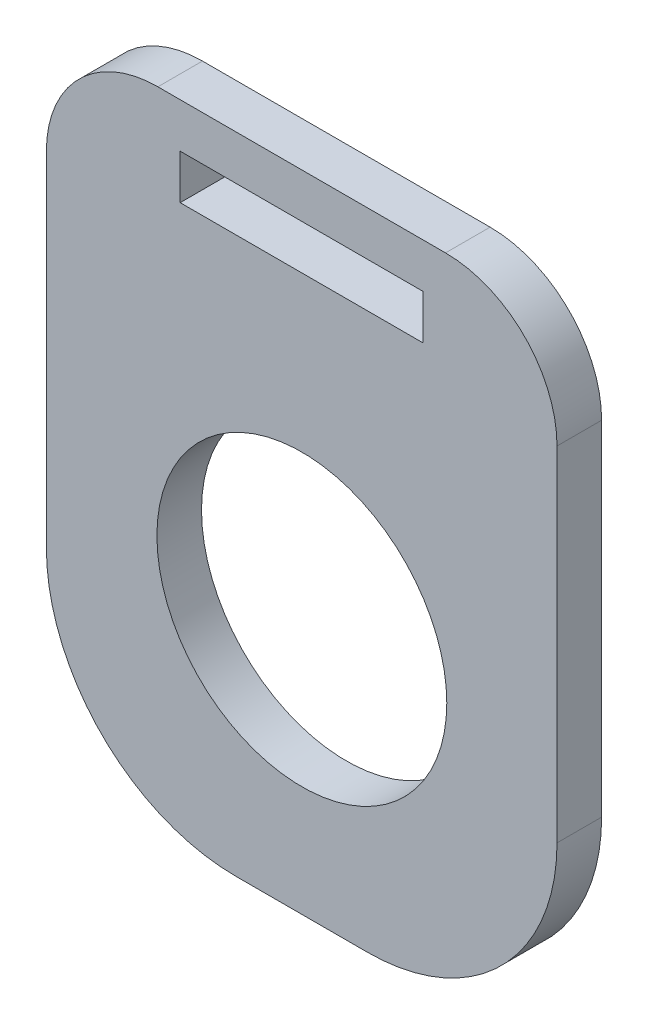
from build123d import *

# Parameters (mm, degrees)
SKETCH1_W               = 58.166
SKETCH1_H               = 73.439999932
BOSS_EXTRUDE1_DEPTH     = 5.08
SKETCH2_W               = 27.686
SKETCH2_H               = 5.08
CUT_EXTRUDE1_DEPTH      = 94.821764778
CUT_EXTRUDE2_DEPTH      = 94.821764778
CUT_EXTRUDE2_DEPTH_BACK = 94.821764778
SKETCH7_R               = 16.51
FILLET2_R               = 21.59
FILLET3_R               = 12.7


with BuildPart() as part:
    # Sketch1 → Boss-Extrude1 (new body)
    with BuildSketch(Plane.XY):
        with Locations((29.083, 36.719999966)):
            Rectangle(SKETCH1_W, SKETCH1_H)
    extrude(amount=BOSS_EXTRUDE1_DEPTH)

    # Sketch2 → Cut-Extrude1 (cut, through all)
    with BuildSketch(Plane.XY.offset(5.08)):
        with Locations((29.083, 65.819999932)):
            Rectangle(SKETCH2_W, SKETCH2_H)
    extrude(amount=-CUT_EXTRUDE1_DEPTH, mode=Mode.SUBTRACT)

    # Sketch7 → Cut-Extrude2 (cut, two sides: drawn at the far end of the back side and taken through both)
    with BuildSketch(Plane.XY.offset(5.08).offset(-CUT_EXTRUDE2_DEPTH_BACK)):
        with Locations((29.099999966, 29.1)):
            Circle(SKETCH7_R)
    extrude(amount=CUT_EXTRUDE2_DEPTH + CUT_EXTRUDE2_DEPTH_BACK, mode=Mode.SUBTRACT)

    # Fillet2
    fillet2_edges = [part.edges().sort_by_distance(p)[0] for p in [
        (58.166, 0, 2.54),
        (0, 0, 2.54),
    ]]
    fillet(fillet2_edges, radius=FILLET2_R)

    # Fillet3
    fillet3_edges = [part.edges().sort_by_distance(p)[0] for p in [
        (0, 73.439999932, 2.54),
        (58.166, 73.439999932, 2.54),
    ]]
    fillet(fillet3_edges, radius=FILLET3_R)


solid = part.part
